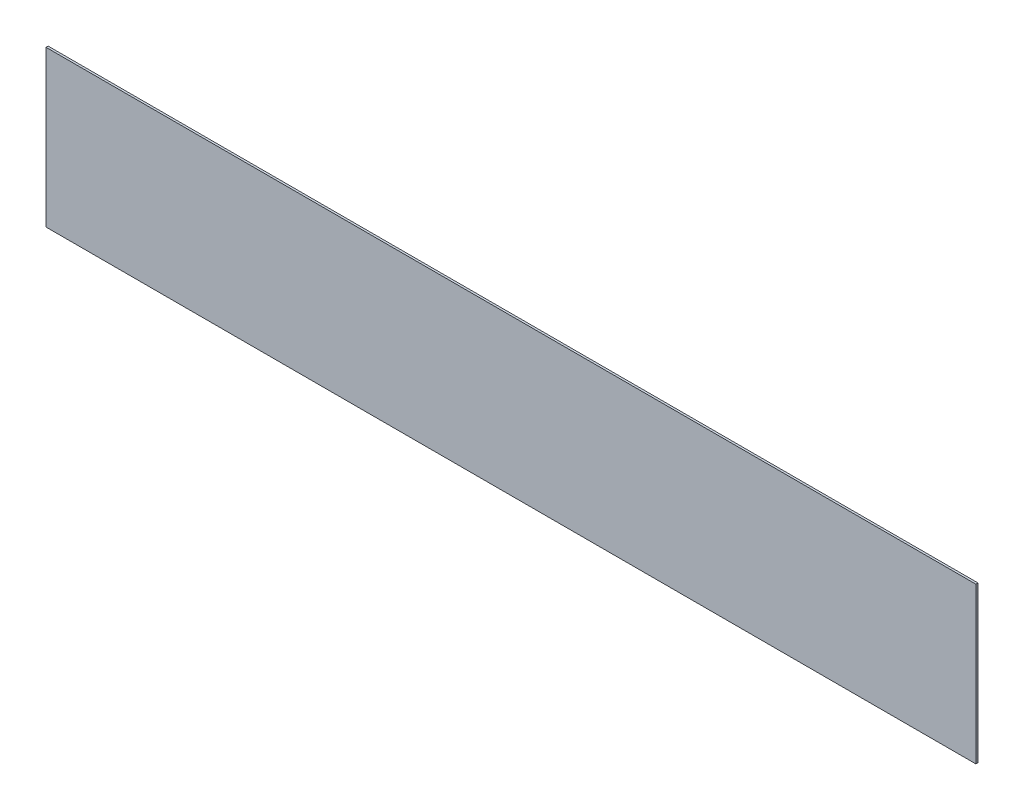
from build123d import *

# Parameters (mm, degrees)
PACK_PLINT_ARKA_1_START = -798.5
SKETCH1_W               = 657
SKETCH1_H               = 110
PACK_PLINT_ARKA_1_DEPTH = 1.5


with BuildPart() as part:
    # Sketch1 → PACK_plint_arka_1 (new body)
    with BuildSketch(Plane.XY.offset(PACK_PLINT_ARKA_1_START)):
        with Locations((350, 65)):
            Rectangle(SKETCH1_W, SKETCH1_H)
    extrude(amount=-PACK_PLINT_ARKA_1_DEPTH)


solid = part.part
